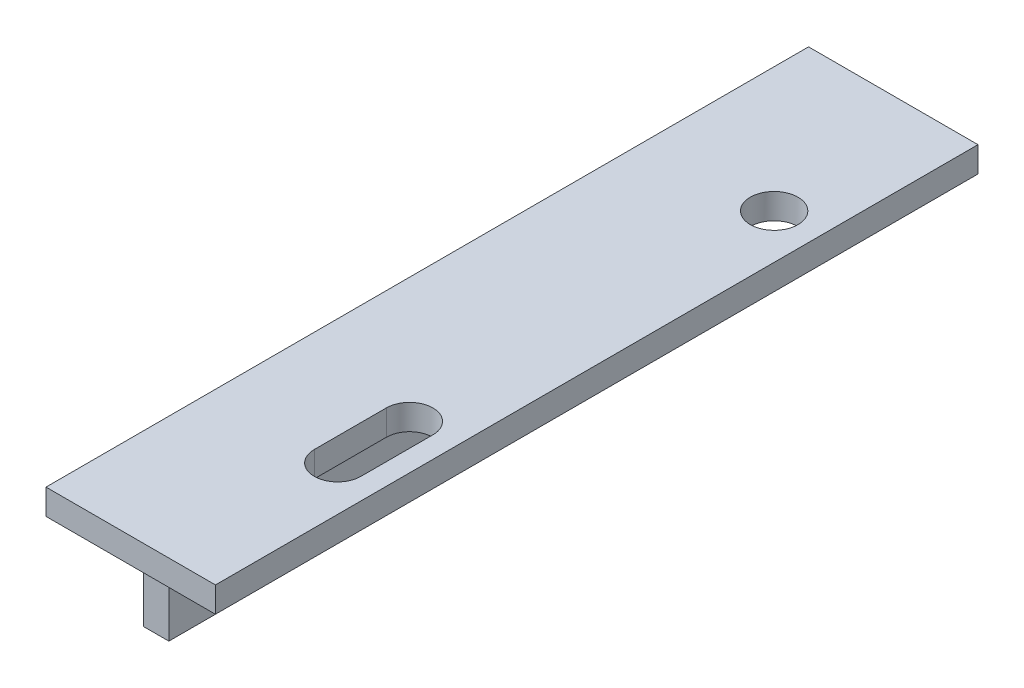
from build123d import *

# Parameters (mm, degrees)
BOSS_EXTRUDE2_DEPTH = 180
SKETCH3_W           = 23
SKETCH3_H           = 34
CUT_EXTRUDE2_DEPTH  = 10
SKETCH4_R           = 5.625
CUT_EXTRUDE3_DEPTH  = 10


with BuildPart() as part:
    # Sketch1 → Boss-Extrude2 (new body)
    with BuildSketch(Plane.XY):
        Polygon((0, 0), (40, 0), (40, -6), (6, -6), (6, -40), (0, -40), align=None)
    extrude(amount=-BOSS_EXTRUDE2_DEPTH)

    # Sketch3 → Cut-Extrude2 (cut)
    with BuildSketch(Plane(origin=(6, 0, 0), x_dir=(0, 0, -1), z_dir=(1, 0, 0))):
        with Locations((11.5, -23)):
            Rectangle(SKETCH3_W, SKETCH3_H)
        with Locations((168.5, -23)):
            Rectangle(SKETCH3_W, SKETCH3_H)
    extrude(amount=-CUT_EXTRUDE2_DEPTH, mode=Mode.SUBTRACT)

    # Sketch4 → Cut-Extrude3 (cut)
    with BuildSketch(Plane(origin=(0, 0, 0), x_dir=(1, 0, 0), z_dir=(0, 1, 0))):
        with Locations(Location((29.48, 142.4, 0), (0, 0, 270))):
            Circle(SKETCH4_R)
        with BuildLine():
            Line((34.98, 56.35), (34.98, 39.35))
            ThreePointArc((34.98, 39.35), (29.48, 33.85), (23.98, 39.35))
            Line((23.98, 39.35), (23.98, 56.35))
            ThreePointArc((23.98, 56.35), (29.48, 61.85), (34.98, 56.35))
        make_face()
    extrude(amount=-CUT_EXTRUDE3_DEPTH, mode=Mode.SUBTRACT)


solid = part.part
